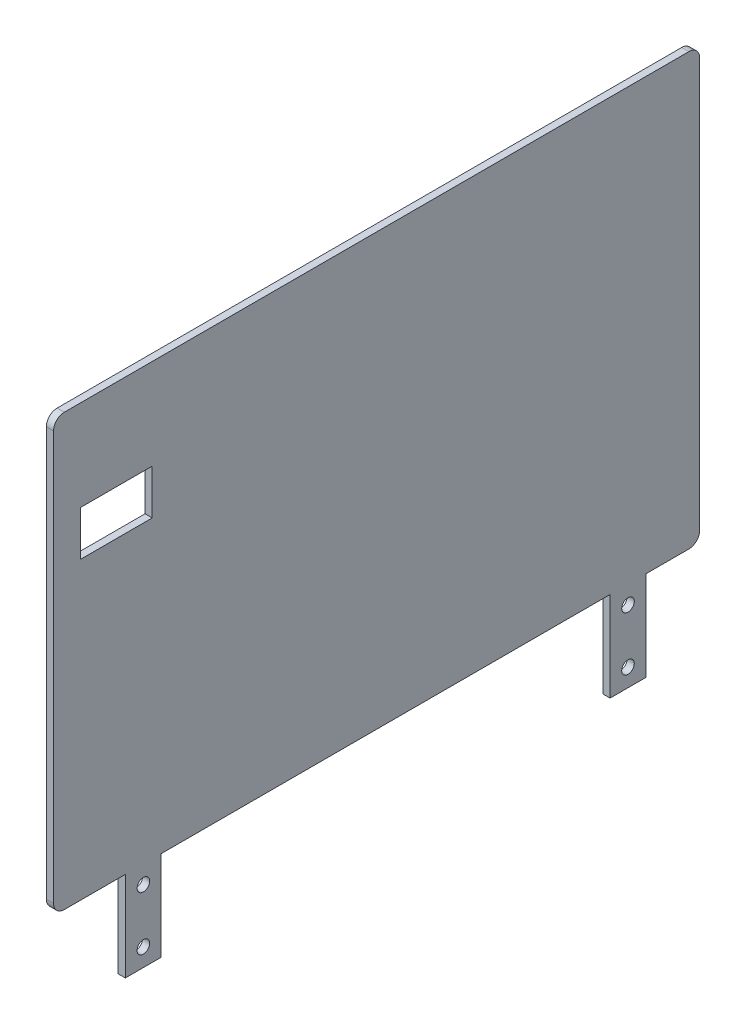
from build123d import *

# Parameters (mm, degrees)
SKETCH2_W             = 360
SKETCH2_H             = 240
BOSS_EXTRUDE2_DEPTH   = 2
FILLET1_R             = 6
SKETCH3_W             = 40
SKETCH3_H             = 25
CUT_EXTRUDE1_DEPTH    = 237.921928069
SKETCH4_W             = 20
SKETCH4_H             = 50
BOSS_EXTRUDE3_DEPTH   = 2
M8X1_0_TAPPED_HOLE1_D = 7


with BuildPart() as part:
    # Sketch2 → Boss-Extrude2 (new, symmetric)
    with BuildSketch(Plane(origin=(0, 0, 0), x_dir=(0, 0, -1), z_dir=(1, 0, 0))):
        with Locations((0, -34)):
            Rectangle(SKETCH2_W, SKETCH2_H)
    extrude(amount=BOSS_EXTRUDE2_DEPTH, both=True)

    # Fillet1
    fillet1_edges = [part.edges().sort_by_distance(p)[0] for p in [
        (0, -154, -180),
        (0, -154, 180),
        (0, 86, 180),
        (0, 86, -180),
    ]]
    fillet(fillet1_edges, radius=FILLET1_R)

    # Sketch3 → Cut-Extrude1 (cut, through all)
    with BuildSketch(Plane(origin=(2, 0, 0), x_dir=(0, 0, -1), z_dir=(1, 0, 0))):
        with Locations((-145, 23)):
            Rectangle(SKETCH3_W, SKETCH3_H)
    extrude(amount=-CUT_EXTRUDE1_DEPTH, mode=Mode.SUBTRACT)

    # Sketch4 → Boss-Extrude3 (add, symmetric)
    with BuildSketch(Plane(origin=(0, 0, 0), x_dir=(0, 0, -1), z_dir=(1, 0, 0))):
        with Locations((-130, -179)):
            Rectangle(SKETCH4_W, SKETCH4_H)
        with Locations((140.074687189, -179)):
            Rectangle(SKETCH4_W, SKETCH4_H)
    extrude(amount=BOSS_EXTRUDE3_DEPTH, both=True)

    # M8x1.0 Tapped Hole1 (through all)
    with Locations(Plane(origin=(2, 0, 0), x_dir=(0, 0, -1), z_dir=(1, 0, 0))):
        with Locations((-129.925312811, -194), (-129.925312811, -164), (140.074687189, -194), (140.074687189, -164)):
            Hole(M8X1_0_TAPPED_HOLE1_D / 2)


solid = part.part
